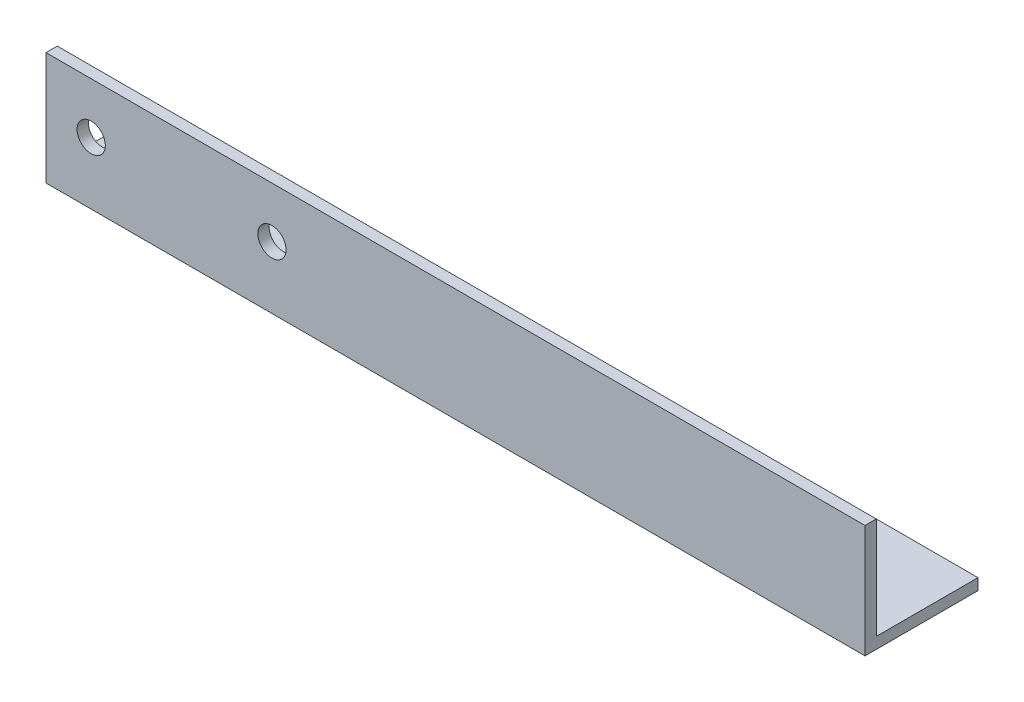
from build123d import *

# Parameters (mm, degrees)
BOSS_EXTRUDE1_DEPTH = 145
SKETCH2_R           = 2.5
CUT_EXTRUDE1_DEPTH  = 2


with BuildPart() as part:
    # Sketch1 → Boss-Extrude1 (new body)
    with BuildSketch(Plane(origin=(0, 0, 0), x_dir=(0, 0, -1), z_dir=(1, 0, 0))):
        Polygon((0, 20), (0, 0), (20, 0), (20, 2), (2, 2), (2, 20), align=None)
    extrude(amount=BOSS_EXTRUDE1_DEPTH)

    # Sketch2 → Cut-Extrude1 (cut)
    with BuildSketch(Plane(origin=(0, 0, -2), x_dir=(-1, 0, 0), z_dir=(0, 0, -1))):
        with Locations(Location((-8, 11, 0), (0, 0, 90))):
            Circle(SKETCH2_R)
        with Locations(Location((-40, 11, 0), (0, 0, 90))):
            Circle(SKETCH2_R)
    extrude(amount=-CUT_EXTRUDE1_DEPTH, mode=Mode.SUBTRACT)


solid = part.part
